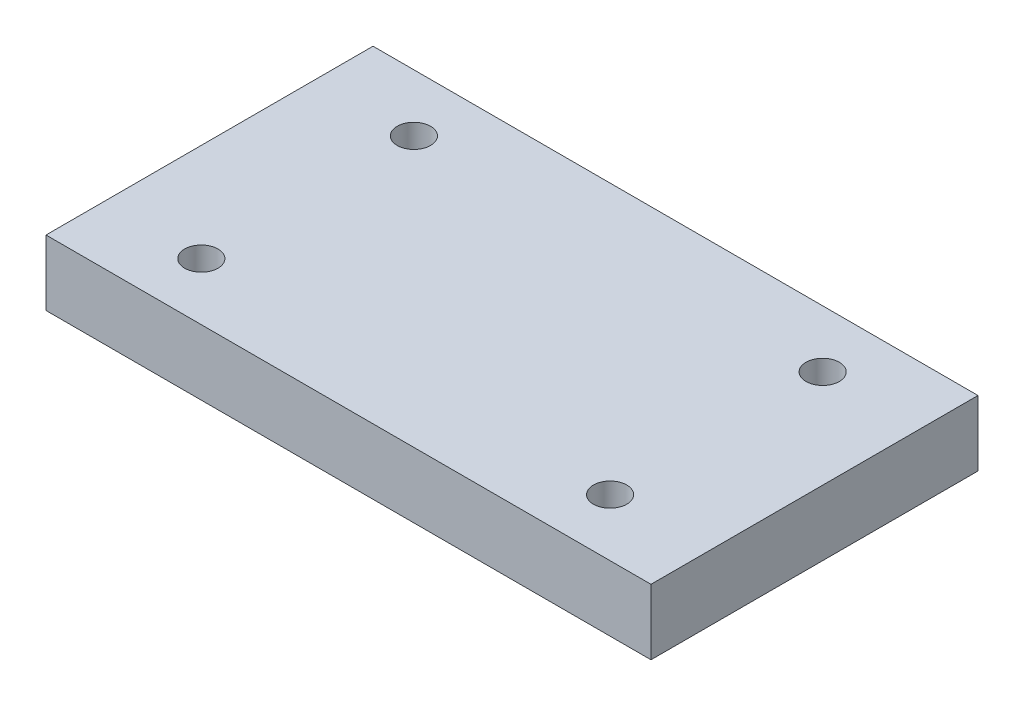
from build123d import *

# Parameters (mm, degrees)
SKETCH1_W           = 185
SKETCH1_H           = 100
BOSS_EXTRUDE1_DEPTH = 20
M12_TAPPED_HOLE1_D  = 10.2


with BuildPart() as part:
    # Sketch1 → Boss-Extrude1 (new body)
    with BuildSketch(Plane(origin=(0, 0, 0), x_dir=(1, 0, 0), z_dir=(0, 1, 0))):
        Rectangle(SKETCH1_W, SKETCH1_H)
    extrude(amount=BOSS_EXTRUDE1_DEPTH)

    # M12 Tapped Hole1 (through all)
    with Locations(Plane(origin=(0, 20, 0), x_dir=(1, 0, 0), z_dir=(0, 1, 0))):
        with Locations((-62.5, 32.5), (62.5, 32.5), (62.5, -32.5), (-62.5, -32.5)):
            Hole(M12_TAPPED_HOLE1_D / 2)


solid = part.part
